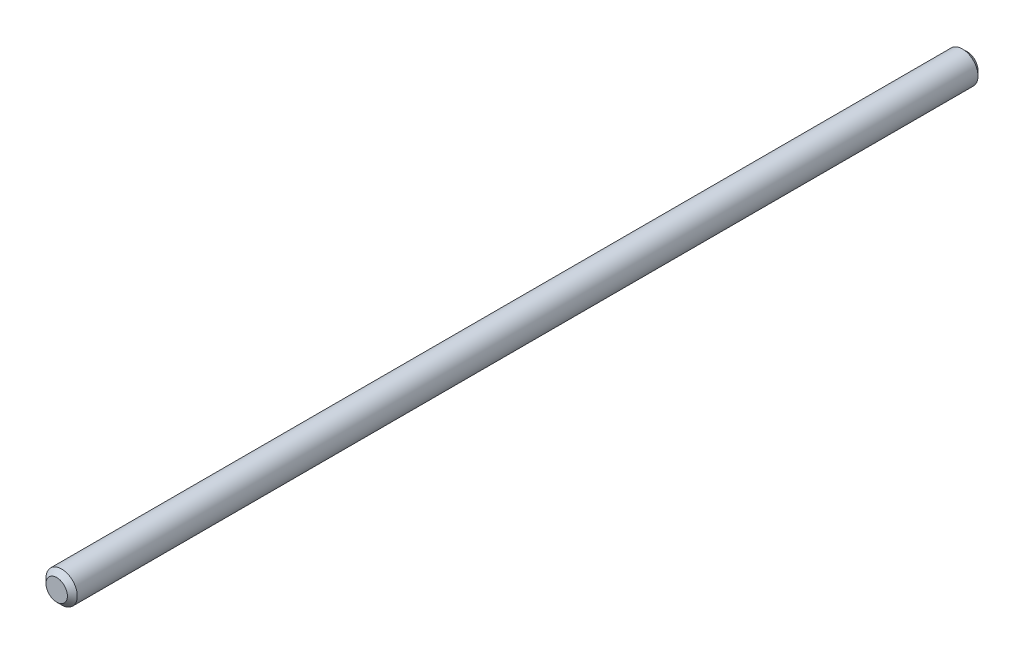
from build123d import *

# Parameters (mm, degrees)
SKETCH1_R           = 3.175
BOSS_EXTRUDE1_DEPTH = 185
CHAMFER1_SIZE       = 1


with BuildPart() as part:
    # Sketch1 → Boss-Extrude1 (new body)
    with BuildSketch(Plane.XY):
        Circle(SKETCH1_R)
    extrude(amount=-BOSS_EXTRUDE1_DEPTH)

    # Chamfer1
    chamfer1_edges = [part.edges().sort_by_distance(p)[0] for p in [
        (-3.175, 0, 0),
        (-3.175, 0, -185),
    ]]
    chamfer(chamfer1_edges, length=CHAMFER1_SIZE)


solid = part.part
